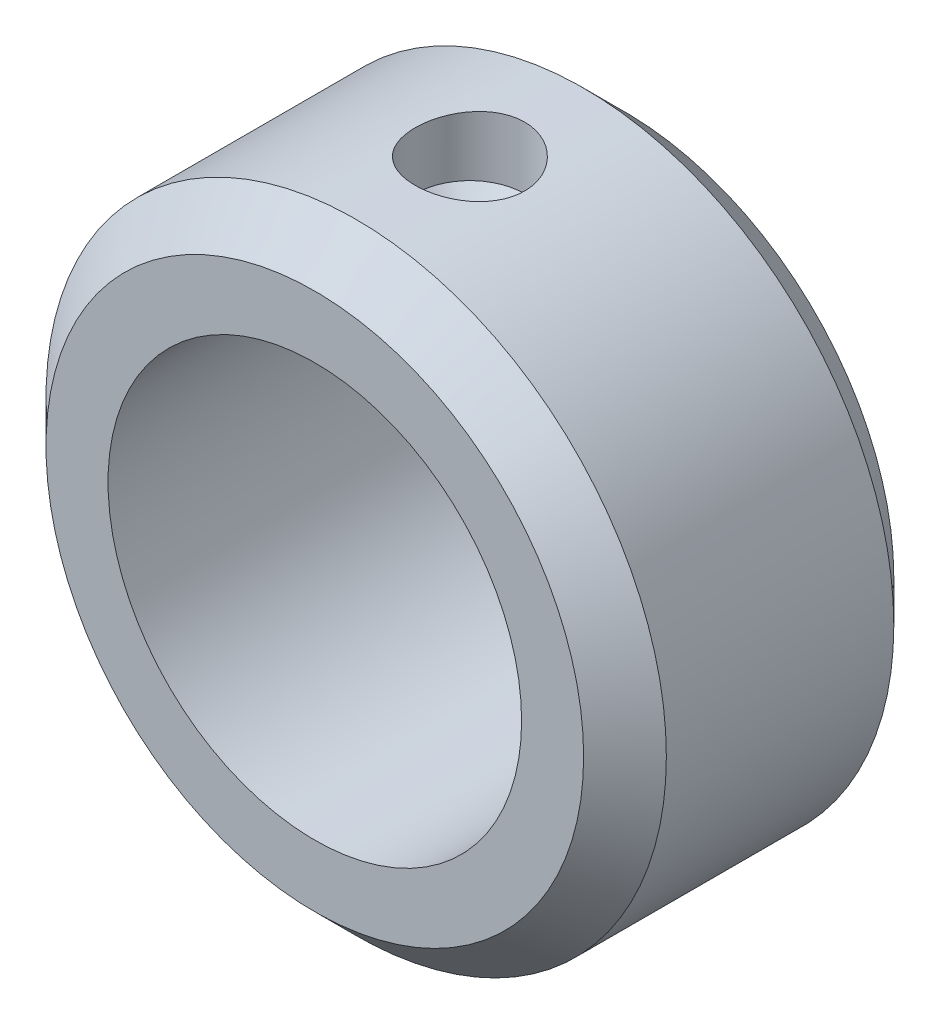
from build123d import *

# Parameters (mm, degrees)
SKETCH_1_R      = 15
SKETCH_1_R_2    = 10
EXTRUDE_1_DEPTH = 15
CHAMFER_1_SIZE  = 2


with BuildPart() as part:
    # Эскиз1 → Бобышка-Вытянуть1 (new body)
    with BuildSketch(Plane.XY):
        Circle(SKETCH_1_R)
        Circle(SKETCH_1_R_2, mode=Mode.SUBTRACT)
    extrude(amount=EXTRUDE_1_DEPTH)

    # Фаска1
    chamfer_1_edges = [part.edges().sort_by_distance(p)[0] for p in [
        (-15, 0, 0),
        (-15, 0, 15),
    ]]
    chamfer(chamfer_1_edges, length=CHAMFER_1_SIZE)

    # Эскиз2 → Вырез-Повернуть1 (revolve, cut)
    with BuildSketch(Plane(origin=(0, 0, 0), x_dir=(0, 0, -1), z_dir=(1, 0, 0)), mode=Mode.PRIVATE) as cut_revolve_1_sk:
        Polygon((-7.5, 15), (-10.15, 15), (-10.15, 12), (-8.5, 10.35), (-7.5, 10.35), align=None)
    revolve(cut_revolve_1_sk.sketch.rotate(Axis((0, 0, 7.5), (0, 1, 0)), 180), axis=Axis((0, 0, 7.5), (0, 1, 0)), mode=Mode.SUBTRACT)


solid = part.part
